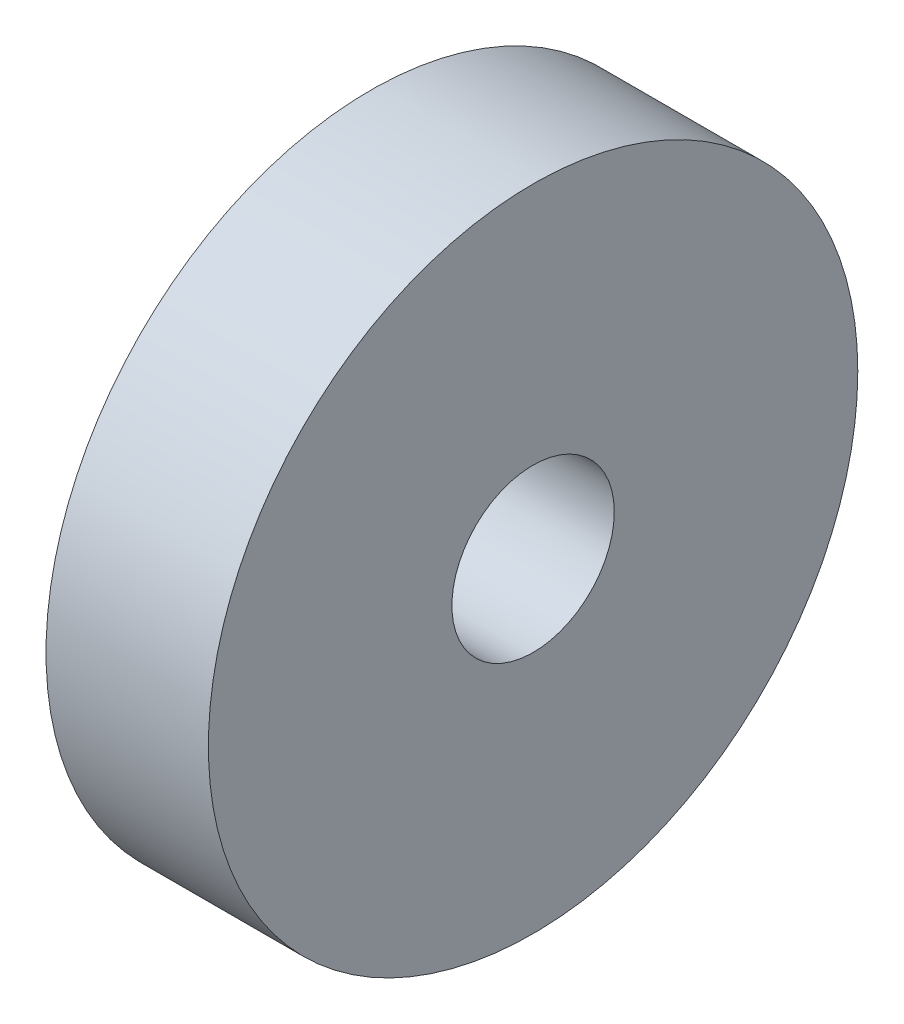
from build123d import *

# Parameters (mm, degrees)
EXTRUDE_1_DEPTH      = 25
EXTRUDE_1_DEPTH_BACK = 25
SKETCH_1_R           = 100
SKETCH_1_R_2         = 25


with BuildPart() as part:
    # Эскиз1 → Бобышка-Вытянуть1 (new, two sides: drawn at the far end of the back side and taken through both)
    with BuildSketch(Plane(origin=(0, 0, 0), x_dir=(0, 0, -1), z_dir=(1, 0, 0)).offset(-EXTRUDE_1_DEPTH_BACK)):
        Circle(SKETCH_1_R)
        Circle(SKETCH_1_R_2, mode=Mode.SUBTRACT)
    extrude(amount=EXTRUDE_1_DEPTH + EXTRUDE_1_DEPTH_BACK)


solid = part.part
